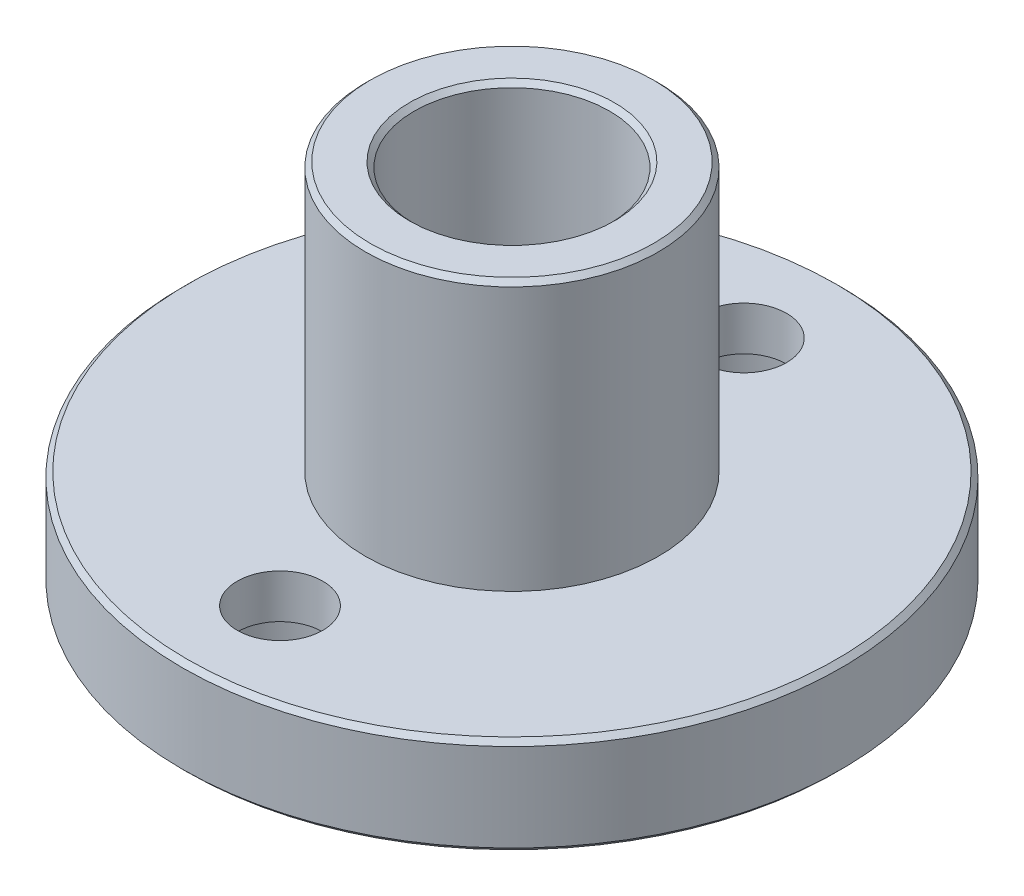
from build123d import *

# Parameters (mm, degrees)
SKETCH_1_R          = 13.5
EXTRUDE_1_DEPTH     = 4
SKETCH_2_R          = 6
EXTRUDE_2_DEPTH     = 11
SKETCH_3_R          = 4
CUT_EXTRUDE_1_DEPTH = 25.279621084
SKETCH_4_R          = 1.75
CUT_EXTRUDE_2_DEPTH = 25.279621084
SKETCH_5_R          = 3
CUT_EXTRUDE_3_DEPTH = 2.2
CHAMFER_1_SIZE      = 0.2


with BuildPart() as part:
    # 草图1 → 凸台-拉伸1 (new body)
    with BuildSketch(Plane(origin=(0, 0, 0), x_dir=(1, 0, 0), z_dir=(0, 1, 0))):
        with Locations(Location((0, 0, 0), (0, 0, 270))):
            Circle(SKETCH_1_R)
    extrude(amount=EXTRUDE_1_DEPTH)

    # 草图2 → 凸台-拉伸2 (add)
    with BuildSketch(Plane(origin=(0, 4, 0), x_dir=(1, 0, 0), z_dir=(0, 1, 0))):
        with Locations(Location((0, 0, 0), (0, 0, 270))):
            Circle(SKETCH_2_R)
    extrude(amount=EXTRUDE_2_DEPTH)

    # 草图3 → 切除-拉伸1 (cut, through all)
    with BuildSketch(Plane(origin=(0, 0, 0), x_dir=(-1, 0, 0), z_dir=(0, -1, 0))):
        with Locations(Location((0, 0, 0), (0, 0, 90))):
            Circle(SKETCH_3_R)
    extrude(amount=-CUT_EXTRUDE_1_DEPTH, mode=Mode.SUBTRACT)

    # 草图4 → 切除-拉伸2 (cut, through all)
    with BuildSketch(Plane.XZ):
        with Locations(Location((0, 9.5, 0), (0, 0, 270))):
            Circle(SKETCH_4_R)
        with Locations(Location((0, -9.5, 0), (0, 0, 270))):
            Circle(SKETCH_4_R)
    extrude(amount=-CUT_EXTRUDE_2_DEPTH, mode=Mode.SUBTRACT)

    # 草图5 → 切除-拉伸3 (cut)
    with BuildSketch(Plane(origin=(0, 0, 0), x_dir=(-1, 0, 0), z_dir=(0, -1, 0))):
        with Locations(Location((0, -9.5, 0), (0, 0, 90))):
            Circle(SKETCH_5_R)
        with Locations(Location((0, 9.5, 0), (0, 0, 90))):
            Circle(SKETCH_5_R)
    extrude(amount=-CUT_EXTRUDE_3_DEPTH, mode=Mode.SUBTRACT)

    # 倒角1
    chamfer_1_edges = [part.edges().sort_by_distance(p)[0] for p in [
        (0, 15, 4),
        (0, 0, -13.5),
        (0, 4, -13.5),
        (0, 15, -6),
    ]]
    chamfer(chamfer_1_edges, length=CHAMFER_1_SIZE)


solid = part.part
